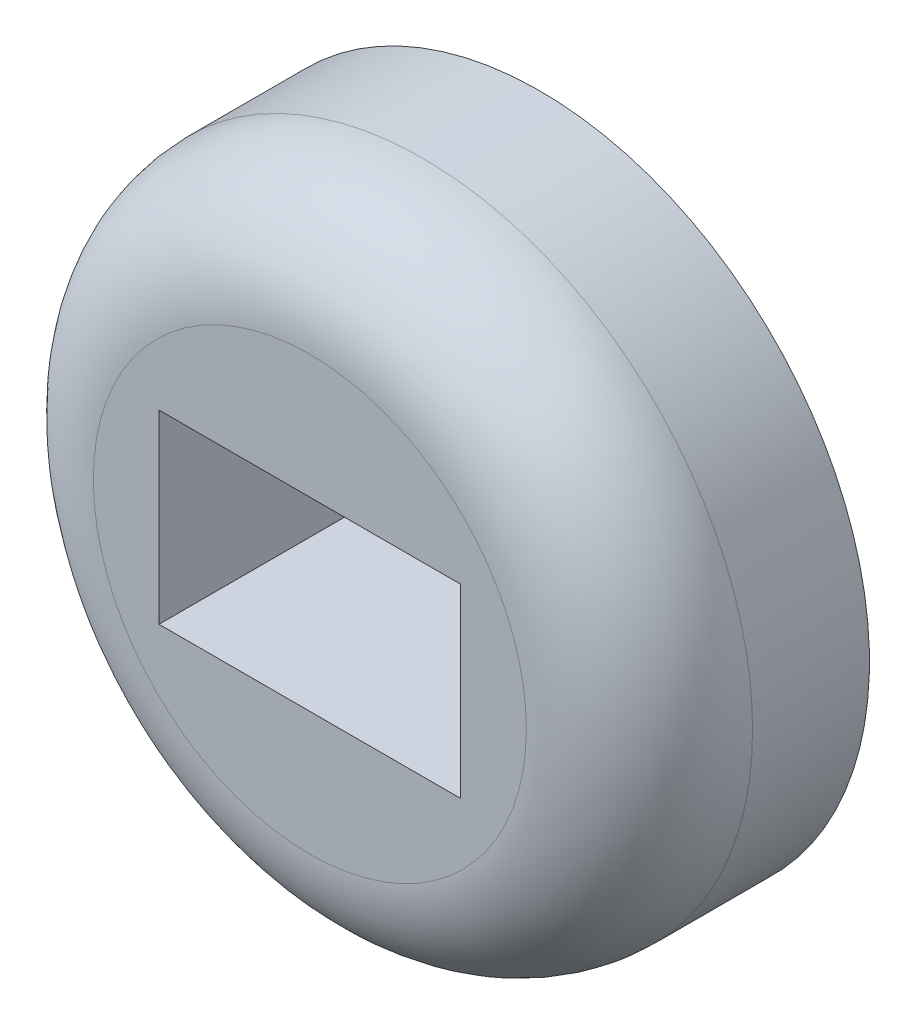
from build123d import *

# Parameters (mm, degrees)
SKETCH1_R           = 87.419609077
BOSS_EXTRUDE1_DEPTH = 61
FILLET1_R           = 30
SKETCH2_W           = 80
SKETCH2_H           = 49.2
CUT_EXTRUDE1_DEPTH  = 61


with BuildPart() as part:
    # Sketch1 → Boss-Extrude1 (new body)
    with BuildSketch(Plane.XY):
        with Locations(Location((0, 0, 0), (0, 0, 180))):
            Circle(SKETCH1_R)
    extrude(amount=BOSS_EXTRUDE1_DEPTH)

    # Fillet1
    fillet1_edges = [part.edges().sort_by_distance(p)[0] for p in [
        (87.419609077, 0, 61),
    ]]
    fillet(fillet1_edges, radius=FILLET1_R)

    # Sketch2 → Cut-Extrude1 (cut)
    with BuildSketch(Plane.XY.offset(61)):
        Rectangle(SKETCH2_W, SKETCH2_H)
    extrude(amount=-CUT_EXTRUDE1_DEPTH, mode=Mode.SUBTRACT)


solid = part.part
